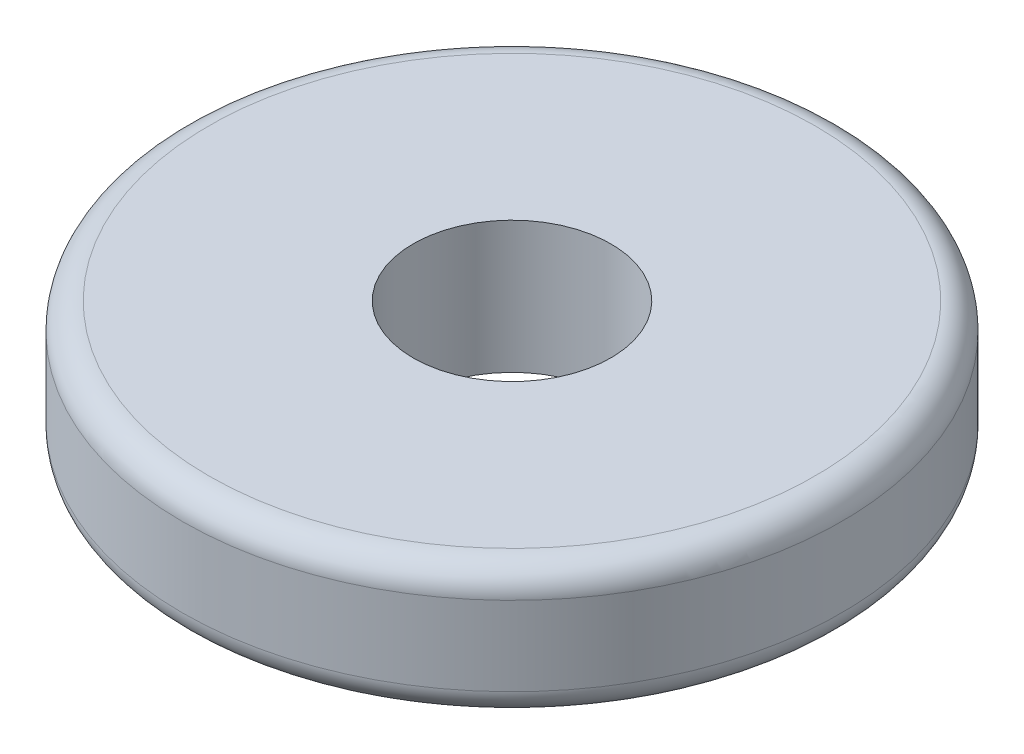
from build123d import *

# Parameters (mm, degrees)
SKETCH1_R           = 31.75
SKETCH1_R_2         = 9.525
BOSS_EXTRUDE1_DEPTH = 12.7
FILLET1_R           = 2.54


with BuildPart() as part:
    # Sketch1 → Boss-Extrude1 (new body)
    with BuildSketch(Plane(origin=(0, 0, 0), x_dir=(1, 0, 0), z_dir=(0, 1, 0))):
        with Locations(Location((0, 0, 0), (0, 0, 270))):
            Circle(SKETCH1_R)
        with Locations(Location((0, 0, 0), (0, 0, 270))):
            Circle(SKETCH1_R_2, mode=Mode.SUBTRACT)
    extrude(amount=BOSS_EXTRUDE1_DEPTH)

    # Fillet1
    fillet1_edges = [part.edges().sort_by_distance(p)[0] for p in [
        (0, 0, -31.75),
        (0, 12.7, -31.75),
    ]]
    fillet(fillet1_edges, radius=FILLET1_R)


solid = part.part
